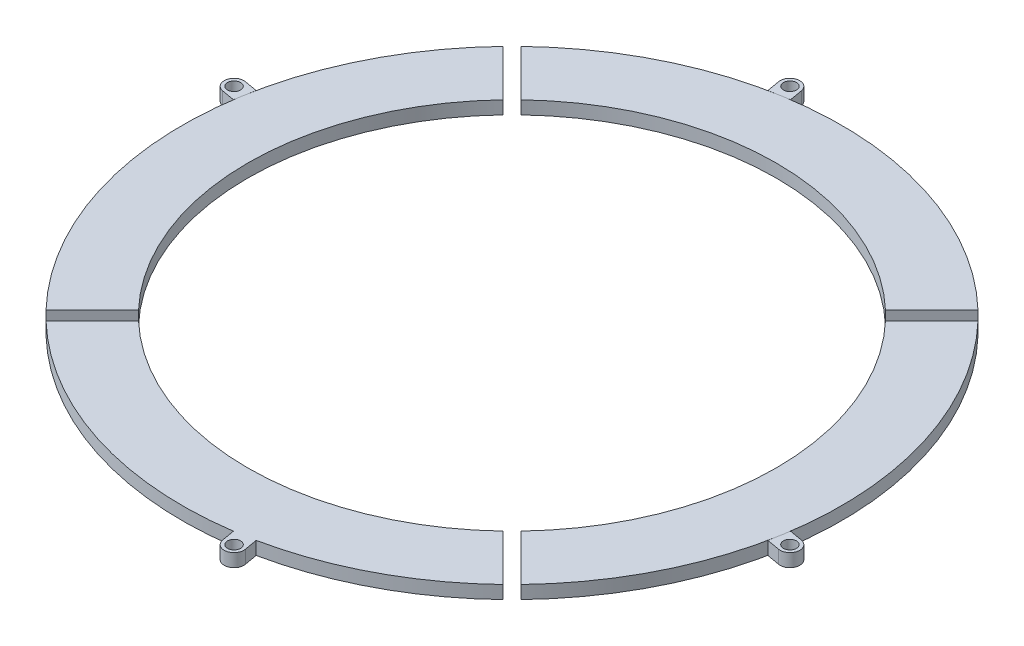
from build123d import *

# Parameters (mm, degrees)
EXTRUDE_1_DEPTH   = 2
EXTRUDE_1_2_DEPTH = 2
EXTRUDE_1_3_DEPTH = 2
EXTRUDE_1_4_DEPTH = 2
SKETCH_2_R        = 1
EXTRUDE_2_DEPTH   = 2


with BuildPart() as part:
    # 草图1 → 凸台-拉伸1 (new body)
    with BuildSketch(Plane(origin=(0, 0, 0), x_dir=(1, 0, 0), z_dir=(0, 1, 0))):
        with BuildLine():
            Line((-36.338272914, -34.924059352), (-29.265468079, -27.851254516))
            ThreePointArc((-29.265468079, -27.851254516), (-40.4, 0), (-29.265468079, 27.851254516))
            Line((-29.265468079, 27.851254516), (-36.338272914, 34.924059352))
            ThreePointArc((-36.338272914, 34.924059352), (-50.4, 0), (-36.338272914, -34.924059352))
        make_face()
    extrude(amount=EXTRUDE_1_DEPTH)


with BuildPart() as body_2:
    # 草图1 → Extrude 1 2 (new body)
    with BuildSketch(Plane(origin=(0, 0, 0), x_dir=(1, 0, 0), z_dir=(0, 1, 0))):
        with BuildLine():
            ThreePointArc((-27.851254516, 29.265468079), (0, 40.4), (27.851254516, 29.265468079))
            Line((27.851254516, 29.265468079), (34.924059352, 36.338272914))
            ThreePointArc((34.924059352, 36.338272914), (0, 50.4), (-34.924059352, 36.338272914))
            Line((-34.924059352, 36.338272914), (-27.851254516, 29.265468079))
        make_face()
    extrude(amount=EXTRUDE_1_2_DEPTH)


with BuildPart() as body_3:
    # 草图1 → Extrude 1 3 (new body)
    with BuildSketch(Plane(origin=(0, 0, 0), x_dir=(1, 0, 0), z_dir=(0, 1, 0))):
        with BuildLine():
            Line((36.338272914, 34.924059352), (29.265468079, 27.851254516))
            ThreePointArc((29.265468079, 27.851254516), (37.513230402, 14.997251242), (40.4, 0))
            ThreePointArc((40.4, 0), (37.513230402, -14.997251242), (29.265468079, -27.851254516))
            Line((29.265468079, -27.851254516), (36.338272914, -34.924059352))
            ThreePointArc((36.338272914, -34.924059352), (46.752587922, -18.824333257), (50.4, 0))
            ThreePointArc((50.4, 0), (46.752587922, 18.824333257), (36.338272914, 34.924059352))
        make_face()
    extrude(amount=EXTRUDE_1_3_DEPTH)


with BuildPart() as body_4:
    # 草图1 → Extrude 1 4 (new body)
    with BuildSketch(Plane(origin=(0, 0, 0), x_dir=(1, 0, 0), z_dir=(0, 1, 0))):
        with BuildLine():
            Line((34.924059352, -36.338272914), (27.851254516, -29.265468079))
            ThreePointArc((27.851254516, -29.265468079), (0, -40.4), (-27.851254516, -29.265468079))
            Line((-27.851254516, -29.265468079), (-34.924059352, -36.338272914))
            ThreePointArc((-34.924059352, -36.338272914), (0, -50.4), (34.924059352, -36.338272914))
        make_face()
    extrude(amount=EXTRUDE_1_4_DEPTH)

    # 草图2 → 凸台-拉伸2 (add)
    # profile 1 of 4: a face of its own
    with BuildSketch(Plane.XZ):
        with BuildLine():
            Line((10.22520285, 49.351851299), (7.270779591, 49.872795832))
            Line((7.270779591, 49.872795832), (7.62195288, 51.864398524))
            ThreePointArc((7.62195288, 51.864398524), (9.359636776, 53.081137887), (10.576376139, 51.343453991))
            Line((10.576376139, 51.343453991), (10.22520285, 49.351851299))
        make_face()
        with Locations(Location((9.09916451, 51.603926258, 0), (0, 0, 270))):
            Circle(SKETCH_2_R, mode=Mode.SUBTRACT)
    # profile 2 of 4: a face of its own
    with BuildSketch(Plane.XZ):
        with BuildLine():
            Line((49.351851299, 10.22520285), (51.343453991, 10.576376139))
            ThreePointArc((51.343453991, 10.576376139), (53.081137887, 9.359636776), (51.864398524, 7.62195288))
            Line((51.864398524, 7.62195288), (49.872795832, 7.270779591))
            Line((49.872795832, 7.270779591), (49.351851299, 10.22520285))
        make_face()
        with Locations(Location((51.603926258, 9.09916451, 0), (0, 0, 90))):
            Circle(SKETCH_2_R, mode=Mode.SUBTRACT)
    # profile 3 of 4: a face of its own
    with BuildSketch(Plane.XZ):
        with BuildLine():
            Line((-49.351851299, -10.22520285), (-51.343453991, -10.576376139))
            ThreePointArc((-51.343453991, -10.576376139), (-53.081137887, -9.359636776), (-51.864398524, -7.62195288))
            Line((-51.864398524, -7.62195288), (-49.872795832, -7.270779591))
            Line((-49.872795832, -7.270779591), (-49.351851299, -10.22520285))
        make_face()
        with Locations(Location((-51.603926258, -9.09916451, 0), (0, 0, 90))):
            Circle(SKETCH_2_R, mode=Mode.SUBTRACT)
    # profile 4 of 4: a face of its own
    with BuildSketch(Plane.XZ):
        with BuildLine():
            Line((-10.22520285, -49.351851299), (-7.270779591, -49.872795832))
            Line((-7.270779591, -49.872795832), (-7.62195288, -51.864398524))
            ThreePointArc((-7.62195288, -51.864398524), (-9.359636776, -53.081137887), (-10.576376139, -51.343453991))
            Line((-10.576376139, -51.343453991), (-10.22520285, -49.351851299))
        make_face()
        with Locations(Location((-9.09916451, -51.603926258, 0), (0, 0, 270))):
            Circle(SKETCH_2_R, mode=Mode.SUBTRACT)
    extrude(amount=-EXTRUDE_2_DEPTH)


with BuildPart() as extrude_2_piece_1:
    # of the separate pieces the step leaves, piece 1, a body of its own (extrude_2_pieces)
    add(body_4.part.solids().sort_by_distance((34.924059352, 0, 36.338272914))[0])


with BuildPart() as extrude_2_piece_2:
    # of the separate pieces the step leaves, piece 2, a body of its own (extrude_2_pieces)
    add(body_4.part.solids().sort_by_distance((-10.576376139, 0, -51.343453991))[0])


with BuildPart() as extrude_2_piece_3:
    # of the separate pieces the step leaves, piece 3, a body of its own (extrude_2_pieces)
    add(body_4.part.solids().sort_by_distance((49.351851299, 0, 10.22520285))[0])


with BuildPart() as extrude_2_piece_4:
    # of the separate pieces the step leaves, piece 4, a body of its own (extrude_2_pieces)
    add(body_4.part.solids().sort_by_distance((-51.864398524, 0, -7.62195288))[0])


solid = Compound([part.part, body_2.part, body_3.part, extrude_2_piece_1.part, extrude_2_piece_2.part, extrude_2_piece_3.part, extrude_2_piece_4.part])
